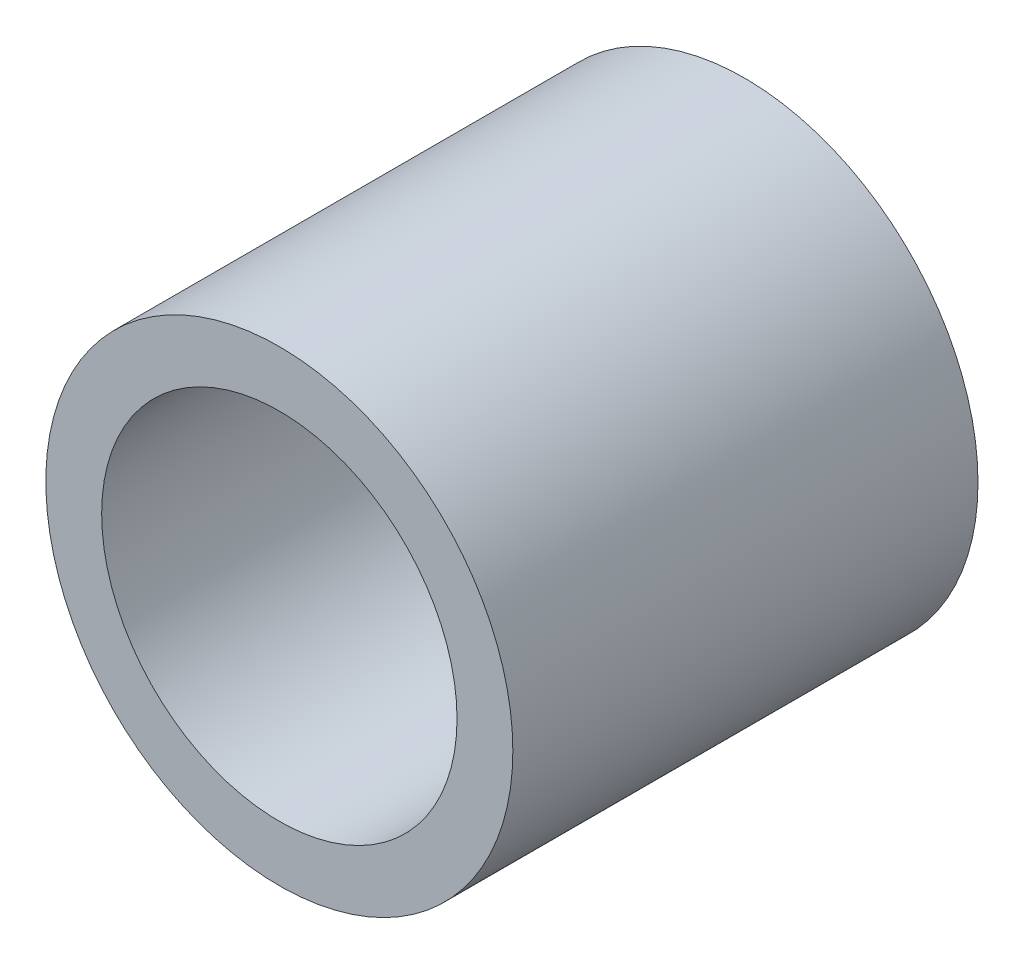
from build123d import *

# Parameters (mm, degrees)
SKETCH1_R      = 3.1877
SKETCH1_R_2    = 2.4257
EXTRUDE1_DEPTH = 3.175


with BuildPart() as part:
    # Sketch1 → Extrude1 (new, symmetric)
    with BuildSketch(Plane.XY):
        Circle(SKETCH1_R)
        Circle(SKETCH1_R_2, mode=Mode.SUBTRACT)
    extrude(amount=EXTRUDE1_DEPTH, both=True)


solid = part.part
